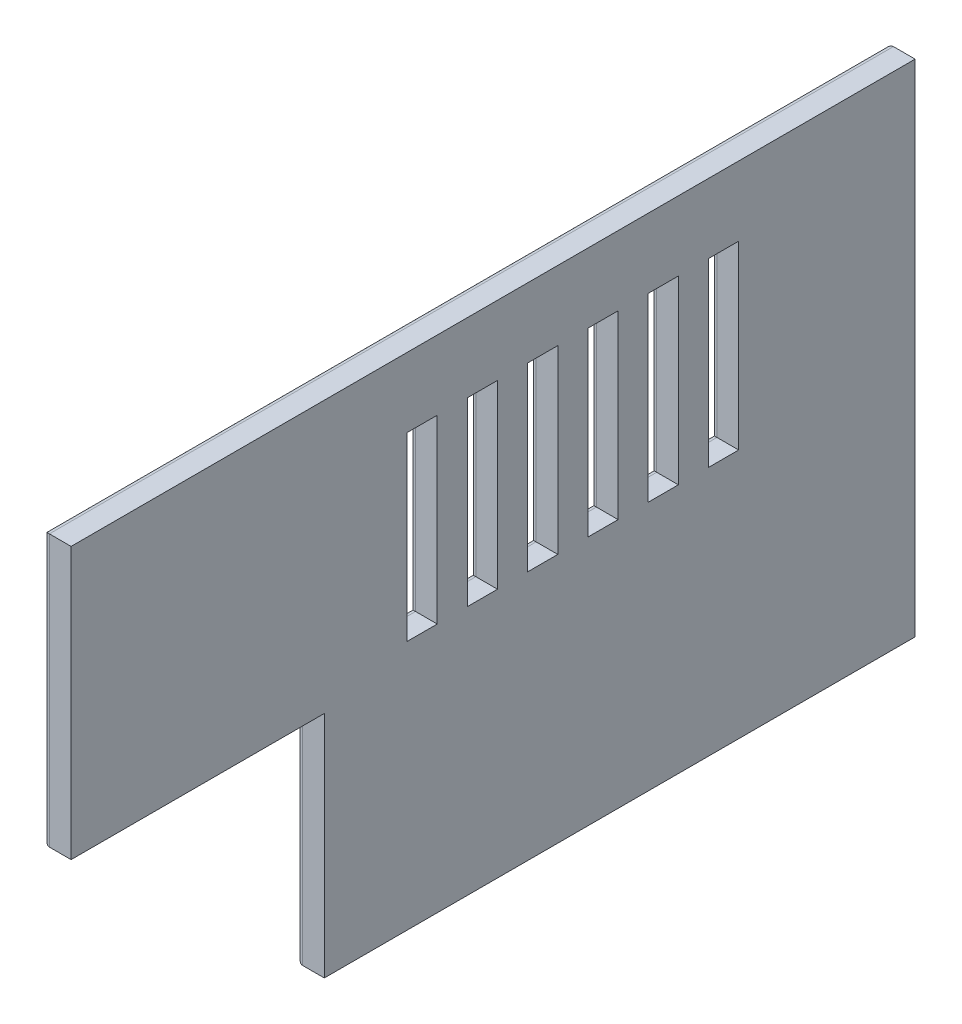
from build123d import *

# Parameters (mm, degrees)
BOSS_EXTRUDE1_DEPTH = 4.6
SKETCH2_W           = 42
SKETCH2_H           = 55
CUT_EXTRUDE1_DEPTH  = 139.94227549
SKETCH4_W           = 5
SKETCH4_H           = 30
CUT_EXTRUDE3_DEPTH  = 10
FILLET1_R           = 1


with BuildPart() as part:
    # Sketch1 → Boss-Extrude1 (new body)
    with BuildSketch(Plane(origin=(0, 0, 0), x_dir=(0, 0, -1), z_dir=(1, 0, 0))):
        Polygon((-27, 80.714285714), (113, 80.714285714), (113, -2.285714286), (13, -2.285714286), (13, -19.285714286), (-27, -19.285714286), align=None)
    extrude(amount=BOSS_EXTRUDE1_DEPTH)

    # Sketch2 → Cut-Extrude1 (cut, through all)
    with BuildSketch(Plane(origin=(4.6, 0, 0), x_dir=(0, 0, -1), z_dir=(1, 0, 0))):
        with Locations((-6, 8.214285714)):
            Rectangle(SKETCH2_W, SKETCH2_H)
    extrude(amount=-CUT_EXTRUDE1_DEPTH, mode=Mode.SUBTRACT)

    # Sketch4 → Cut-Extrude3 (cut)
    with BuildSketch(Plane.ZY):
        with Locations((-41.233318098, 54.194727162)):
            Rectangle(SKETCH4_W, SKETCH4_H)
        with Locations((-31.233318098, 54.194727162)):
            Rectangle(SKETCH4_W, SKETCH4_H)
        with Locations((-51.233318098, 54.194727162)):
            Rectangle(SKETCH4_W, SKETCH4_H)
        with Locations((-61.233318098, 54.194727162)):
            Rectangle(SKETCH4_W, SKETCH4_H)
        with Locations((-71.233318098, 54.194727162)):
            Rectangle(SKETCH4_W, SKETCH4_H)
        with Locations((-81.233318098, 54.194727162)):
            Rectangle(SKETCH4_W, SKETCH4_H)
    extrude(amount=-CUT_EXTRUDE3_DEPTH, mode=Mode.SUBTRACT)

    # Fillet1
    fillet1_edges = [part.edges().sort_by_distance(p)[0] for p in [
        (0, 39.194727162, -71.233318098),
        (0, 54.194727162, -68.733318098),
        (0, 69.194727162, -71.233318098),
        (0, 54.194727162, -73.733318098),
        (0, 39.194727162, -81.233318098),
        (0, 54.194727162, -78.733318098),
        (0, 69.194727162, -81.233318098),
        (0, 54.194727162, -83.733318098),
        (0, -2.285714286, -64),
        (0, 16.714285714, -15),
        (0, 35.714285714, 6),
        (0, 80.714285714, -43),
        (0, 39.214285714, -113),
        (0, 54.194727162, -28.733318098),
        (0, 69.194727162, -31.233318098),
        (0, 54.194727162, -33.733318098),
        (0, 39.194727162, -31.233318098),
        (0, 39.194727162, -41.233318098),
        (0, 54.194727162, -38.733318098),
        (0, 69.194727162, -41.233318098),
        (0, 54.194727162, -43.733318098),
        (0, 58.214285714, 27),
        (0, 39.194727162, -51.233318098),
        (0, 54.194727162, -48.733318098),
        (0, 69.194727162, -51.233318098),
        (0, 54.194727162, -53.733318098),
        (0, 39.194727162, -61.233318098),
        (0, 54.194727162, -58.733318098),
        (0, 69.194727162, -61.233318098),
        (0, 54.194727162, -63.733318098),
    ]]
    fillet(fillet1_edges, radius=FILLET1_R)


solid = part.part
